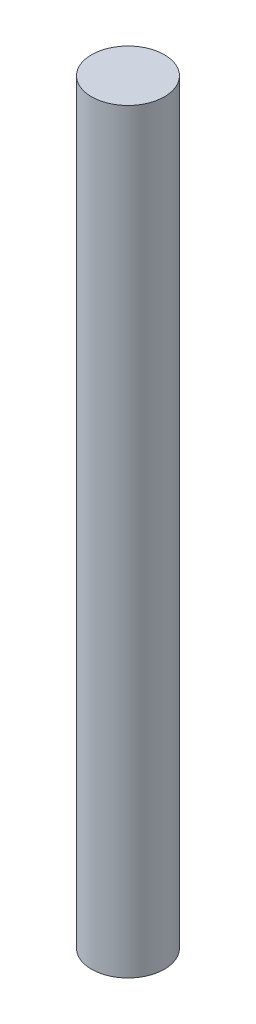
from build123d import *

# Parameters (mm, degrees)
SKETCH1_W = 4.28625
SKETCH1_H = 88.9


with BuildPart() as part:
    # Sketch1 → Revolve1 (revolve)
    with BuildSketch(Plane.XY, mode=Mode.PRIVATE) as revolve1_sk:
        with Locations((-2.143125, 44.45)):
            Rectangle(SKETCH1_W, SKETCH1_H)
    revolve(revolve1_sk.sketch.rotate(Axis((0, 88.9, 0), (0, -1, 0)), 270), axis=Axis((0, 88.9, 0), (0, -1, 0)))


solid = part.part
